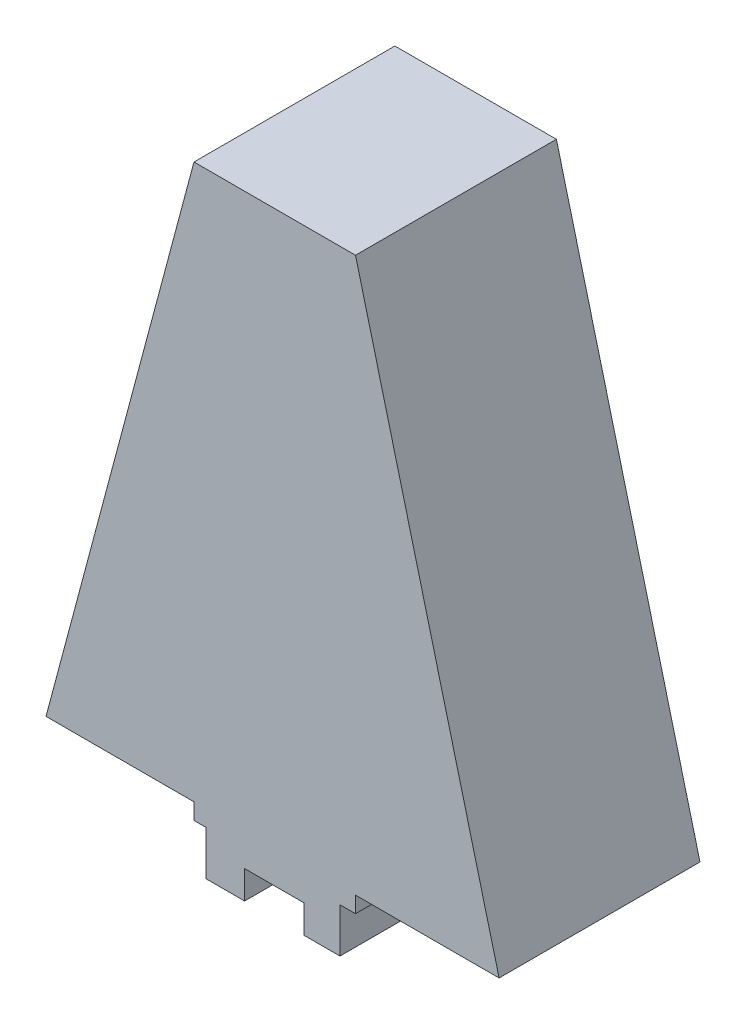
from build123d import *

# Parameters (mm, degrees)
BOSS_EXTRUDE1_DEPTH = 0.025


with BuildPart() as part:
    # Sketch1 → Boss-Extrude1 (new body)
    with BuildSketch(Plane.XY):
        Polygon((0.008165184, -0.070964452), (0.010099043, -0.070964452), (0.010099043, -0.068959778), (0.027969052, -0.068959778), (0.010099043, 0), (-0.01, 0), (-0.028413629, -0.068959778), (-0.01, -0.068959778), (-0.01, -0.070964452), (-0.0085, -0.070964452), (-0.0085, -0.072999999), (-0.0085, -0.076499999), (-0.0037, -0.076499999), (-0.0037, -0.072999999), (0.0037, -0.072999999), (0.0037, -0.076499999), (0.008165184, -0.076499999), (0.008165184, -0.072999999), align=None)
    extrude(amount=BOSS_EXTRUDE1_DEPTH)


solid = part.part
